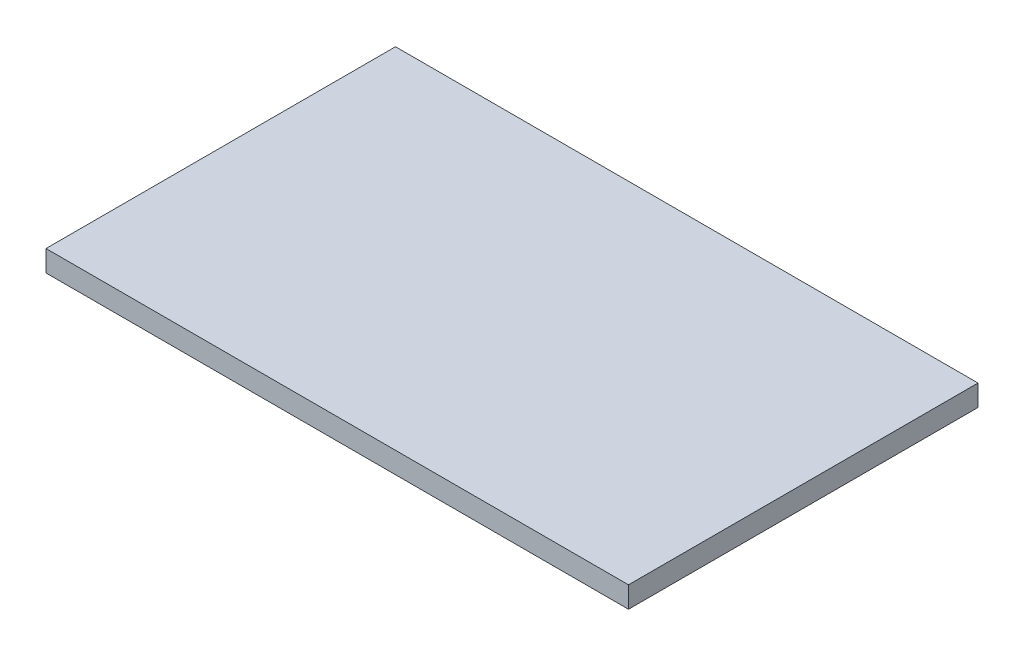
from build123d import *

# Parameters (mm, degrees)
SKETCH_1_W          = 550
SKETCH_1_H          = 330
EXTRUDE_1_DEPTH     = 20
SKETCH_2_W          = 530
SKETCH_2_H          = 310
CUT_EXTRUDE_1_DEPTH = 3


with BuildPart() as part:
    # Эскиз1 → Бобышка-Вытянуть1 (new body)
    with BuildSketch(Plane(origin=(0, 0, 0), x_dir=(1, 0, 0), z_dir=(0, 1, 0))):
        with Locations((275, 165)):
            Rectangle(SKETCH_1_W, SKETCH_1_H)
    extrude(amount=EXTRUDE_1_DEPTH)

    # Эскиз2 → Вырез-Вытянуть1 (cut)
    with BuildSketch(Plane.XZ):
        with Locations((275, -165)):
            Rectangle(SKETCH_2_W, SKETCH_2_H)
    extrude(amount=-CUT_EXTRUDE_1_DEPTH, mode=Mode.SUBTRACT)


solid = part.part
